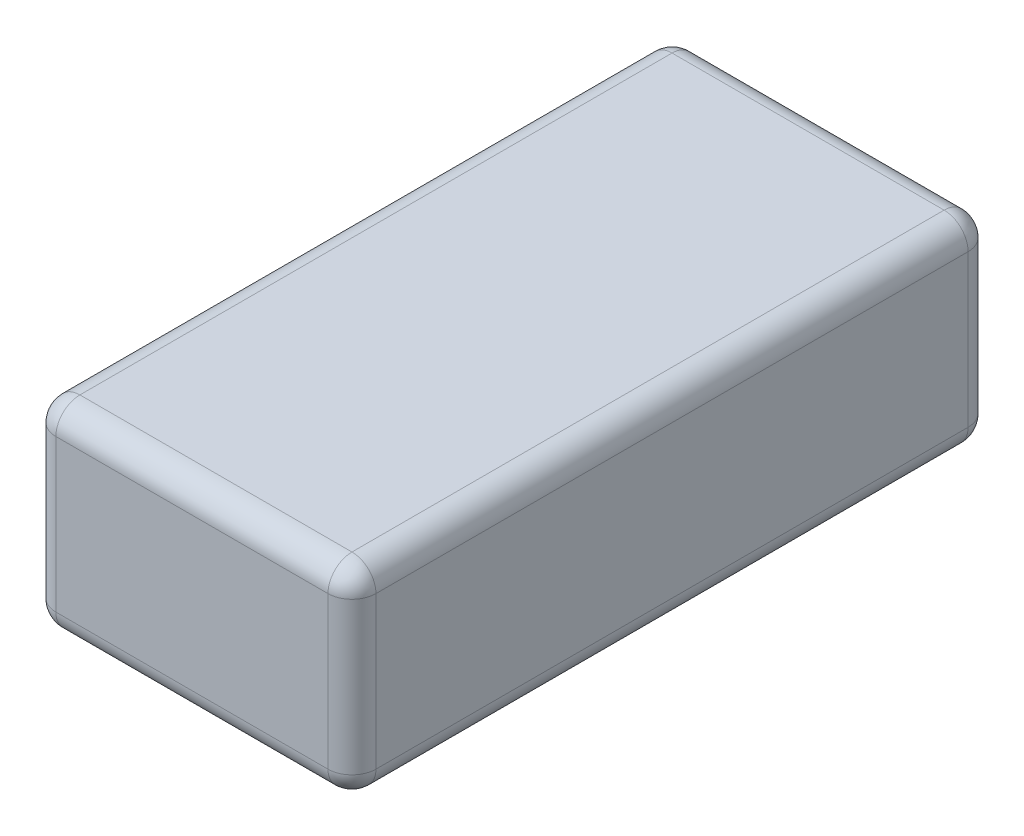
from build123d import *

# Parameters (mm, degrees)
SKETCH1_W           = 40
SKETCH1_H           = 80
BOSS_EXTRUDE1_DEPTH = 25
FILLET2_R           = 3


with BuildPart() as part:
    # Sketch1 → Boss-Extrude1 (new body)
    with BuildSketch(Plane(origin=(0, 0, 0), x_dir=(1, 0, 0), z_dir=(0, 1, 0))):
        Rectangle(SKETCH1_W, SKETCH1_H)
    extrude(amount=BOSS_EXTRUDE1_DEPTH)

    # Fillet2
    fillet2_edges = [part.edges().sort_by_distance(p)[0] for p in [
        (-20, 25, 0),
        (0, 25, 40),
        (20, 25, 0),
        (0, 0, 40),
        (-20, 0, 0),
        (0, 0, -40),
        (20, 0, 0),
        (20, 12.5, 40),
        (-20, 12.5, 40),
        (-20, 12.5, -40),
        (20, 12.5, -40),
        (0, 25, -40),
    ]]
    fillet(fillet2_edges, radius=FILLET2_R)


solid = part.part
